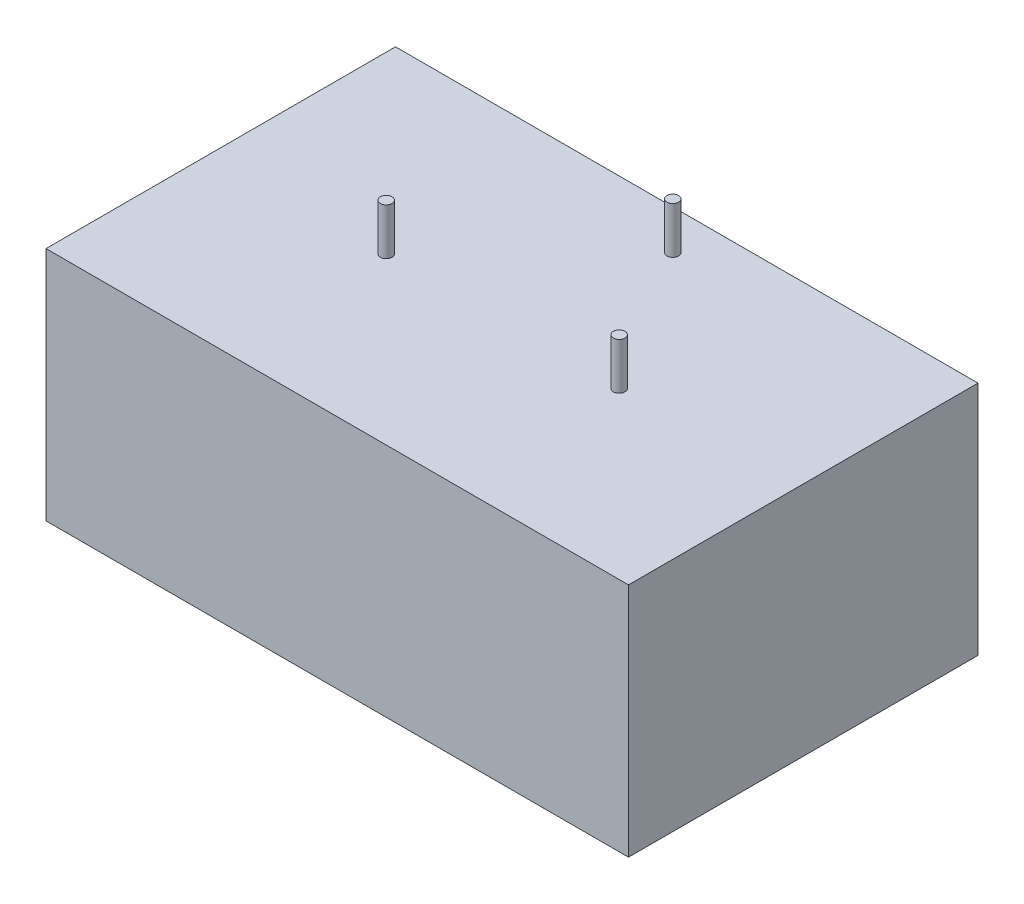
from build123d import *

# Parameters (mm, degrees)
SKETCH_2_W          = 250
SKETCH_2_H          = 150
EXTRUDE_1_DEPTH     = 80.07
SKETCH_6_R          = 7.5
CUT_EXTRUDE_1_DEPTH = 20
SKETCH_7_W          = 250
SKETCH_7_H          = 150
EXTRUDE_2_DEPTH     = 21.15
SKETCH_13_R         = 2.5
EXTRUDE_4_DEPTH     = 20
SKETCH_15_R         = 2.5
EXTRUDE_5_DEPTH     = 20


with BuildPart() as part:
    # 草图2 → 凸台-拉伸1 (new body)
    with BuildSketch(Plane(origin=(0, 0, 0), x_dir=(1, 0, 0), z_dir=(0, 1, 0))):
        Rectangle(SKETCH_2_W, SKETCH_2_H)
    extrude(amount=EXTRUDE_1_DEPTH)

    # 草图6 → 切除-拉伸1 (cut)
    with BuildSketch(Plane(origin=(0, 0, -75), x_dir=(-1, 0, 0), z_dir=(0, 0, -1))):
        with Locations((-22.5, 40.035)):
            Circle(SKETCH_6_R)
        with Locations((22.5, 40.035)):
            Circle(SKETCH_6_R)
    extrude(amount=-CUT_EXTRUDE_1_DEPTH, mode=Mode.SUBTRACT)

    # 草图7 → 凸台-拉伸2 (add)
    with BuildSketch(Plane(origin=(0, 80.07, 0), x_dir=(1, 0, 0), z_dir=(0, 1, 0))):
        Rectangle(SKETCH_7_W, SKETCH_7_H)
    extrude(amount=EXTRUDE_2_DEPTH)

    # 草图13 → 凸台-拉伸4 (add)
    with BuildSketch(Plane(origin=(0, 101.22, 0), x_dir=(1, 0, 0), z_dir=(0, 1, 0))):
        with Locations(Location((11, 58, 0), (0, 0, 270))):
            Circle(SKETCH_13_R)
    extrude(amount=EXTRUDE_4_DEPTH)

    # 草图15 → 凸台-拉伸5 (add)
    with BuildSketch(Plane(origin=(0, 101.22, 0), x_dir=(1, 0, 0), z_dir=(0, 1, 0))):
        with Locations(Location((50, -4, 0), (0, 0, 270))):
            Circle(SKETCH_15_R)
        with Locations(Location((-50, -4, 0), (0, 0, 90))):
            Circle(SKETCH_15_R)
    extrude(amount=EXTRUDE_5_DEPTH)


solid = part.part
